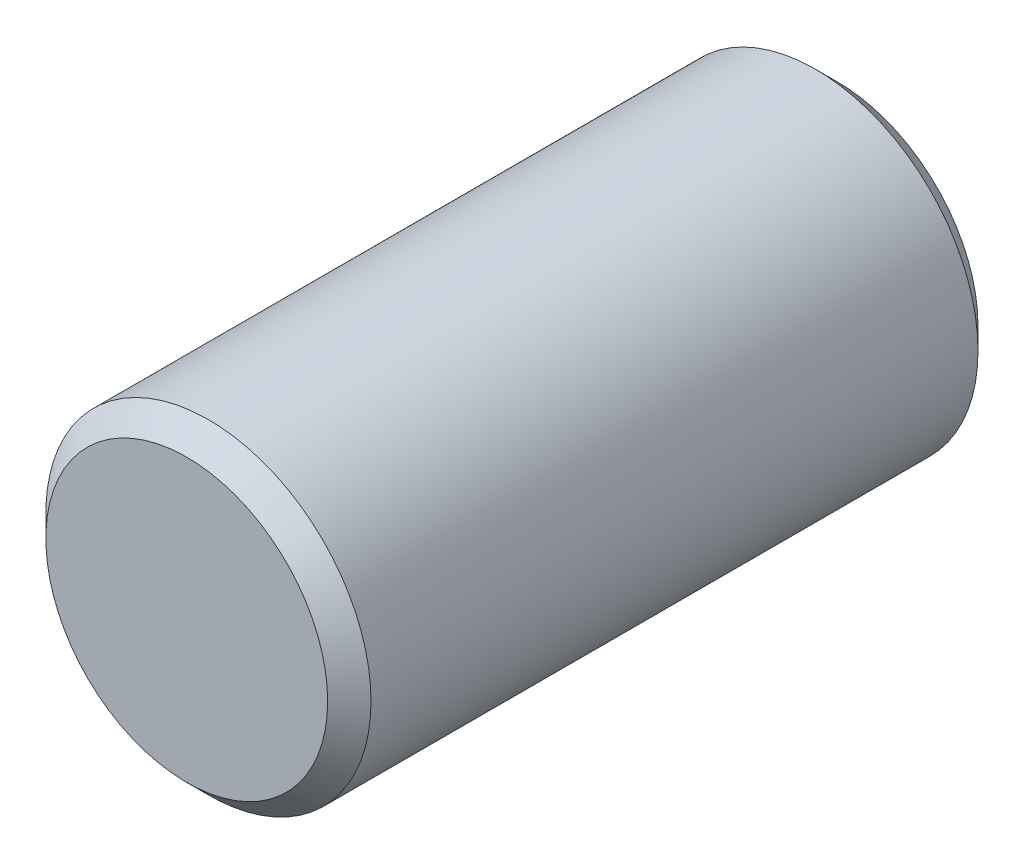
from build123d import *

# Parameters (mm, degrees)
SKETCH1_R           = 0.75
BOSS_EXTRUDE1_DEPTH = 1.5
CHAMFER1_SIZE       = 0.1


with BuildPart() as part:
    # Sketch1 → Boss-Extrude1 (new, symmetric)
    with BuildSketch(Plane.XY):
        Circle(SKETCH1_R)
    extrude(amount=BOSS_EXTRUDE1_DEPTH, both=True)

    # Chamfer1
    chamfer1_edges = [part.edges().sort_by_distance(p)[0] for p in [
        (-0.75, 0, -1.5),
        (-0.75, 0, 1.5),
    ]]
    chamfer(chamfer1_edges, length=CHAMFER1_SIZE)


solid = part.part
